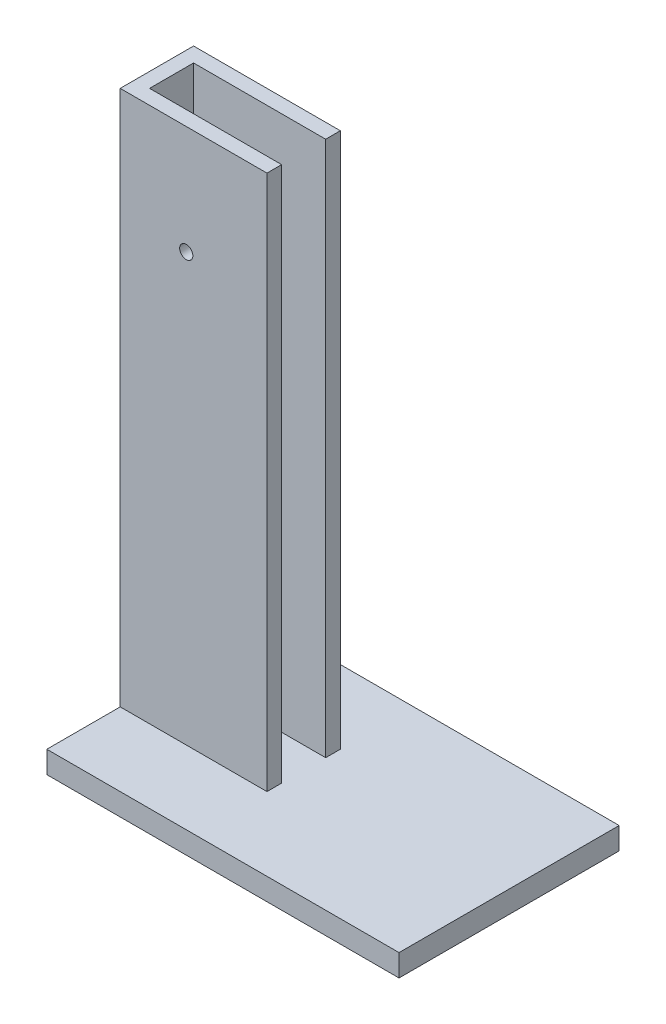
from build123d import *

# Parameters (mm, degrees)
BOSS_EXTRUDE1_DEPTH     = 730
SKETCH2_W               = 480
SKETCH2_H               = 300
BOSS_EXTRUDE2_DEPTH     = 30
CUT_EXTRUDE1_DEPTH      = 29
CUT_EXTRUDE1_DEPTH_BACK = 23
SKETCH5_R               = 9


with BuildPart() as part:
    # Sketch1 → Boss-Extrude1 (new body)
    with BuildSketch(Plane(origin=(0, 0, 0), x_dir=(1, 0, 0), z_dir=(0, 1, 0))):
        Polygon((-80, 30), (100, 30), (100, 50), (-100, 50), (-100, -50), (100, -50), (100, -30), (-80, -30), align=None)
    extrude(amount=BOSS_EXTRUDE1_DEPTH)

    # Sketch5 → Cut-Extrude1 (cut, two sides: drawn at the far end of the back side and taken through both)
    with BuildSketch(Plane(origin=(0, 0, 30), x_dir=(-1, 0, 0), z_dir=(0, 0, -1)).offset(-CUT_EXTRUDE1_DEPTH_BACK)):
        with Locations(Location((10, 581.9, 0), (0, 0, 180))):
            Circle(SKETCH5_R)
    extrude(amount=CUT_EXTRUDE1_DEPTH + CUT_EXTRUDE1_DEPTH_BACK, mode=Mode.SUBTRACT)


with BuildPart() as body_2:
    # Sketch2 → Boss-Extrude2 (new body)
    with BuildSketch(Plane.XZ):
        with Locations((140, 0)):
            Rectangle(SKETCH2_W, SKETCH2_H)
    extrude(amount=BOSS_EXTRUDE2_DEPTH)


solid = Compound([part.part, body_2.part])
